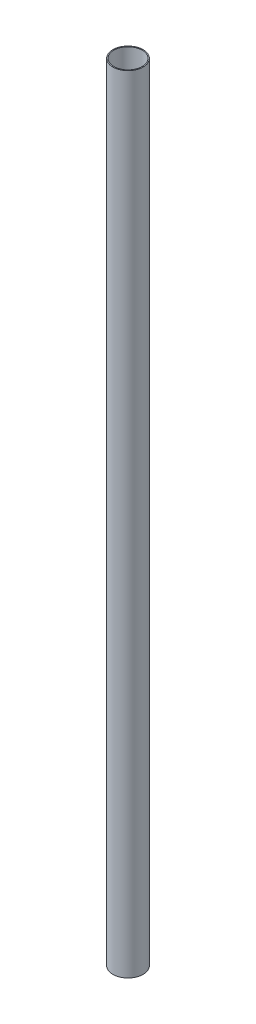
from build123d import *

# Parameters (mm, degrees)
SKETCH1_R           = 31.75
SKETCH1_R_2         = 29.75
BOSS_EXTRUDE1_DEPTH = 1650


with BuildPart() as part:
    # Sketch1 → Boss-Extrude1 (new body)
    with BuildSketch(Plane(origin=(0, 0, 0), x_dir=(1, 0, 0), z_dir=(0, 1, 0))):
        with Locations(Location((0, 0, 0), (0, 0, 270))):
            Circle(SKETCH1_R)
        with Locations(Location((0, 0, 0), (0, 0, 270))):
            Circle(SKETCH1_R_2, mode=Mode.SUBTRACT)
    extrude(amount=BOSS_EXTRUDE1_DEPTH)


solid = part.part
